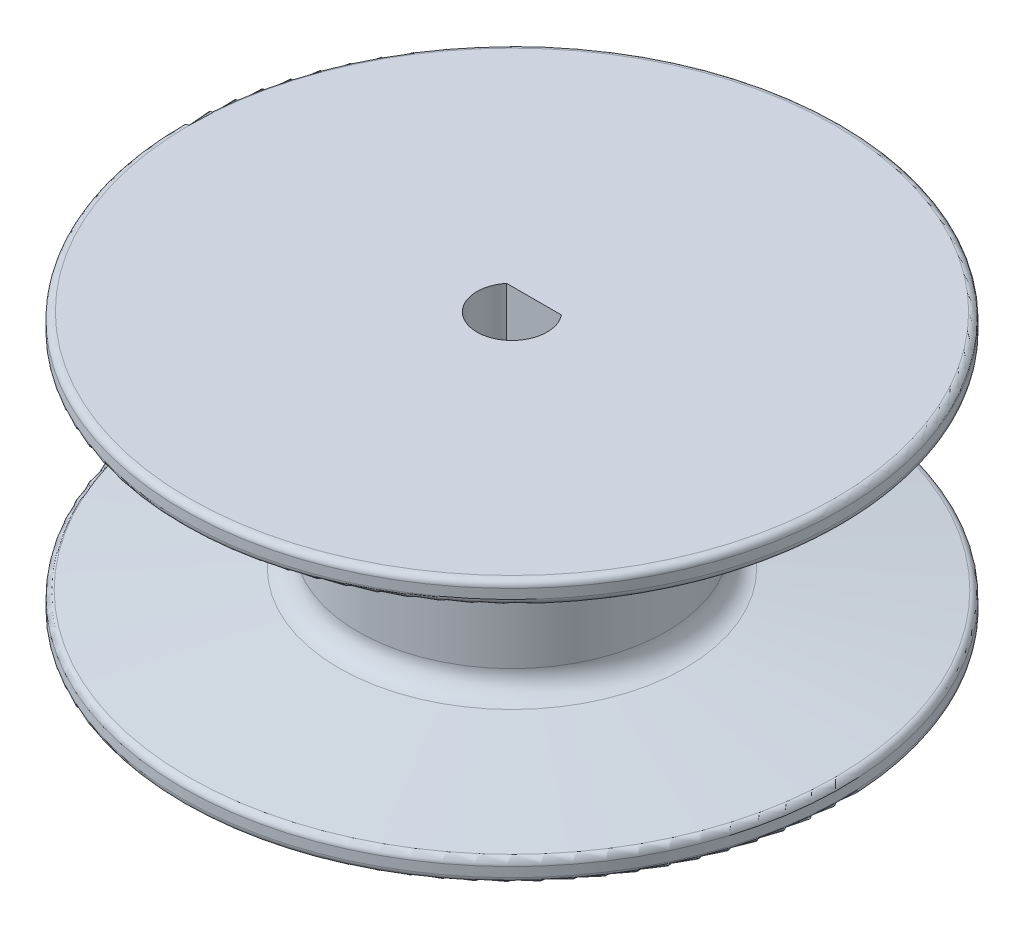
from build123d import *

# Parameters (mm, degrees)
CUT_EXTRUDE1_START = -12
CUT_EXTRUDE1_DEPTH = 37.372115214
FILLET1_R          = 1
FILLET2_R          = 0.3
CUT_EXTRUDE2_DEPTH = 10.5


with BuildPart() as part:
    # Sketch1 → Revolve1 (revolve)
    with BuildSketch(Plane.XY, mode=Mode.PRIVATE) as revolve1_sk:
        Polygon((0, 0), (-15, 0), (-15, -1), (-7, -2), (-7, -6), (0, -6), align=None)
    revolve1 = revolve(revolve1_sk.sketch.rotate(Axis((0, -6, 0), (0, 1, 0)), 270), axis=Axis((0, -6, 0), (0, 1, 0)))

    # Mirror1: Revolve1 across plane
    add(revolve1.mirror(Plane(origin=(-7, -6, 0), x_dir=(0, 0, 1), z_dir=(0, 1, 0))))

    # Sketch2 → Cut-Extrude1 (cut, through all)
    with BuildSketch(Plane(origin=(0, 0, 0), x_dir=(1, 0, 0), z_dir=(0, 1, 0)).offset(CUT_EXTRUDE1_START)):
        with BuildLine():
            Line((-1.2489996, 1), (1.2489996, 1))
            ThreePointArc((1.2489996, 1), (0, -1.6), (-1.2489996, 1))
        make_face()
    extrude(amount=CUT_EXTRUDE1_DEPTH, mode=Mode.SUBTRACT)

    # Fillet1
    fillet1_edges = [part.edges().sort_by_distance(p)[0] for p in [
        (0, -10, 7),
        (0, -2, 7),
    ]]
    fillet(fillet1_edges, radius=FILLET1_R)

    # Fillet2
    fillet2_edges = [part.edges().sort_by_distance(p)[0] for p in [
        (0, -12, 15),
        (0, -11, 15),
        (0, -1, 15),
        (0, 0, 15),
    ]]
    fillet(fillet2_edges, radius=FILLET2_R)

    # Sketch3 → Cut-Extrude2 (cut)
    with BuildSketch(Plane.XY.offset(-11)):
        with BuildLine():
            ThreePointArc((1.75, -6), (1.237436867, -4.762563133), (0, -4.25))
            Line((0, -4.25), (0, -7.75))
            ThreePointArc((0, -7.75), (1.237436867, -7.237436867), (1.75, -6))
        make_face()
        with BuildLine():
            Line((0, -7.75), (0, -4.25))
            ThreePointArc((0, -4.25), (-1.75, -6), (0, -7.75))
        make_face()
    extrude(amount=CUT_EXTRUDE2_DEPTH, mode=Mode.SUBTRACT)


solid = part.part
